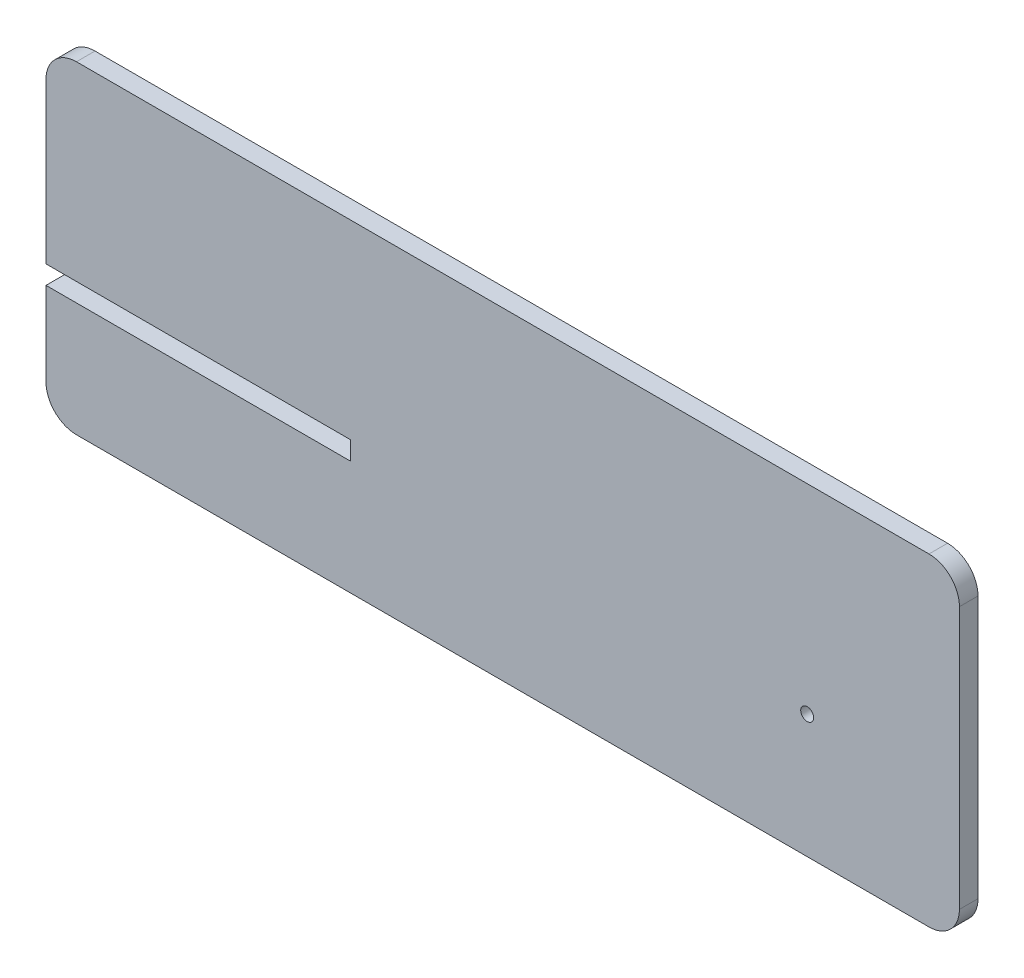
from build123d import *

# Parameters (mm, degrees)
BOSS_EXTRUDE1_DEPTH = 3.0988
SKETCH3_R           = 1.0795
BOSS_EXTRUDE2_DEPTH = 3.0988
FILLET1_R           = 5.08


with BuildPart() as part:
    # Sketch2 → Boss-Extrude1 (new body)
    with BuildSketch(Plane.XY):
        Polygon((-50.8, 1.5494), (-50.8, 7.8994), (50.8, 7.8994), (50.8, -7.8994), (-50.8, -7.8994), (-50.8, -1.5494), (0, -1.5494), (0, 1.5494), align=None)
    extrude(amount=BOSS_EXTRUDE1_DEPTH)

    # Sketch3 → Boss-Extrude2 (add)
    with BuildSketch(Plane.XY):
        Polygon((50.8, -7.8994), (-50.8, -7.8994), (-50.8, -20.5994), (101.6, -20.5994), (101.6, 33.2994), (-50.8, 33.2994), (-50.8, 7.8994), (50.8, 7.8994), align=None)
        with Locations((76.2, 0)):
            Circle(SKETCH3_R, mode=Mode.SUBTRACT)
    extrude(amount=BOSS_EXTRUDE2_DEPTH)

    # Fillet1
    fillet1_edges = [part.edges().sort_by_distance(p)[0] for p in [
        (101.6, -20.5994, 1.5494),
        (101.6, 33.2994, 1.5494),
        (-50.8, 33.2994, 1.5494),
        (-50.8, -20.5994, 1.5494),
    ]]
    fillet(fillet1_edges, radius=FILLET1_R)


solid = part.part
